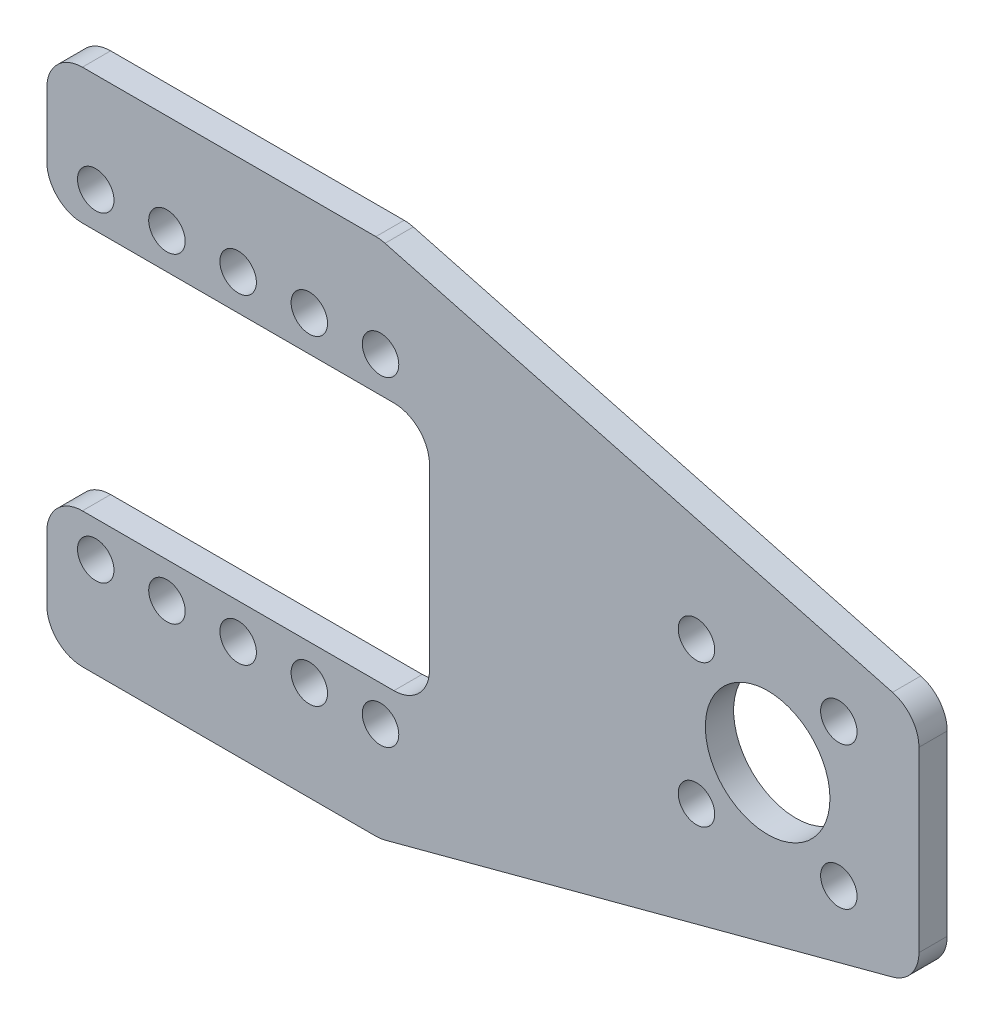
from build123d import *

# Parameters (mm, degrees)
SKETCH1_R           = 7
SKETCH1_R_2         = 2.05
BOSS_EXTRUDE2_DEPTH = 3.175
FILLET2_R           = 4


with BuildPart() as part:
    # Sketch1 → Boss-Extrude2 (new body)
    with BuildSketch(Plane.XY):
        Polygon((37.5, -43.175), (0, -43.175), (0, -28), (43, -28), (43, 0), (0, 0), (0, 15.175), (37.5, 15.175), (98, -0.934242296), (98, -27.065757704), align=None)
        with Locations((81, -14)):
            Circle(SKETCH1_R, mode=Mode.SUBTRACT)
        with Locations((13.5, -32)):
            Circle(SKETCH1_R_2, mode=Mode.SUBTRACT)
        with Locations((29.5, -32)):
            Circle(SKETCH1_R_2, mode=Mode.SUBTRACT)
        with Locations((73, -6)):
            Circle(SKETCH1_R_2, mode=Mode.SUBTRACT)
        with Locations((89, -6)):
            Circle(SKETCH1_R_2, mode=Mode.SUBTRACT)
        with Locations((89, -22)):
            Circle(SKETCH1_R_2, mode=Mode.SUBTRACT)
        with Locations((73, -22)):
            Circle(SKETCH1_R_2, mode=Mode.SUBTRACT)
        with Locations((5.5, 4)):
            Circle(SKETCH1_R_2, mode=Mode.SUBTRACT)
        with Locations((13.5, 4)):
            Circle(SKETCH1_R_2, mode=Mode.SUBTRACT)
        with Locations((21.5, 4)):
            Circle(SKETCH1_R_2, mode=Mode.SUBTRACT)
        with Locations((29.5, 4)):
            Circle(SKETCH1_R_2, mode=Mode.SUBTRACT)
        with Locations((37.5, 4)):
            Circle(SKETCH1_R_2, mode=Mode.SUBTRACT)
        with Locations((37.5, -32)):
            Circle(SKETCH1_R_2, mode=Mode.SUBTRACT)
        with Locations((21.5, -32)):
            Circle(SKETCH1_R_2, mode=Mode.SUBTRACT)
        with Locations((5.5, -32)):
            Circle(SKETCH1_R_2, mode=Mode.SUBTRACT)
    extrude(amount=BOSS_EXTRUDE2_DEPTH)

    # Fillet2
    fillet2_edges = [part.edges().sort_by_distance(p)[0] for p in [
        (0, -43.175, 1.5875),
        (0, -28, 1.5875),
        (43, -28, 1.5875),
        (43, 0, 1.5875),
        (0, 0, 1.5875),
        (0, 15.175, 1.5875),
        (37.5, 15.175, 1.5875),
        (98, -0.934242296, 1.5875),
        (98, -27.065757704, 1.5875),
        (37.5, -43.175, 1.5875),
    ]]
    fillet(fillet2_edges, radius=FILLET2_R)


solid = part.part
